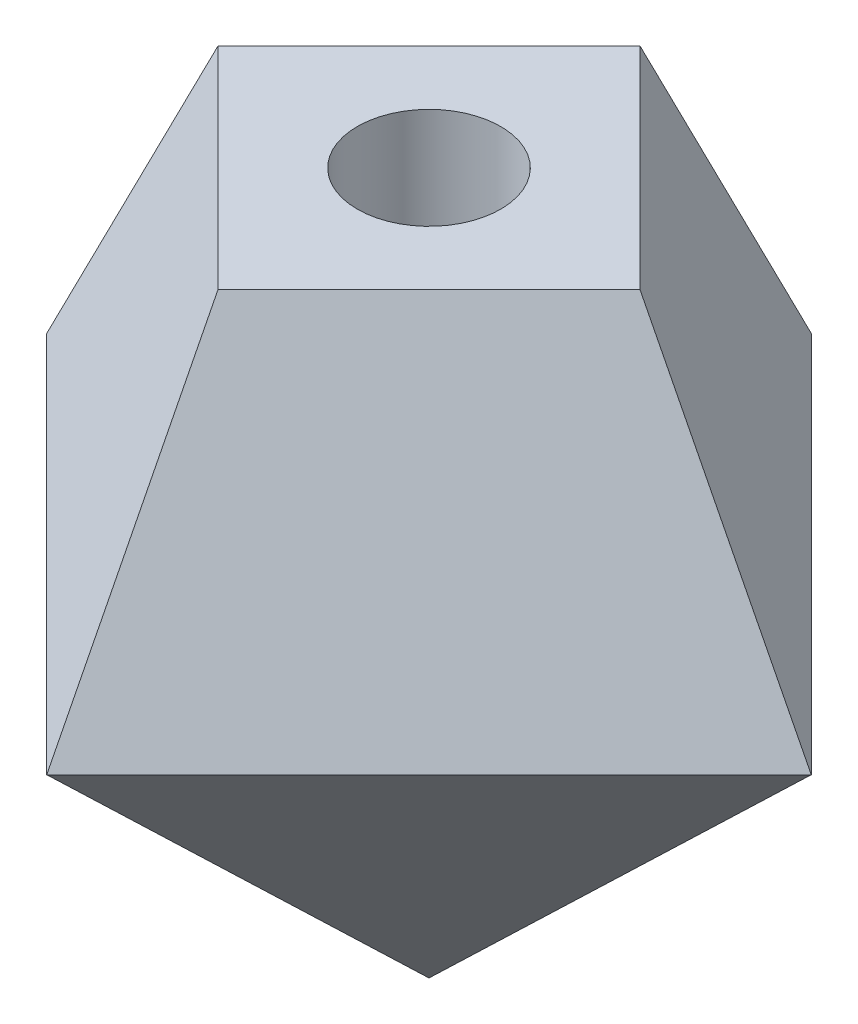
from build123d import *

# Parameters (mm, degrees)
BOSS_EXTRUDE1_DEPTH = 25.4
SKETCH2_W           = 48.842738796
SKETCH2_H           = 57.963308492
CUT_EXTRUDE1_DEPTH  = 25.4
CIRPATTERN1_COUNT   = 4
BOSS_EXTRUDE2_DEPTH = 25.4
SKETCH4_W           = 55.511744094
SKETCH4_H           = 37.462262811
CUT_EXTRUDE2_DEPTH  = 25.4
CIRPATTERN2_COUNT   = 4
SKETCH5_R           = 4.7625
CUT_EXTRUDE3_DEPTH  = 25.4


with BuildPart() as part:
    # Sketch1 → Boss-Extrude1 (new body)
    with BuildSketch(Plane.XY):
        Polygon((64.875616583, 27.293462823), (90.275616583, 27.293462823), (90.275616583, 49.518462823), (76.253828643, 49.518462823), align=None)
    boss_extrude1 = extrude(amount=BOSS_EXTRUDE1_DEPTH)

    # Sketch2 → Cut-Extrude1 (cut)
    with BuildSketch(Plane(origin=(22.502369916, -11.520213127, -22.502369916), x_dir=(0.7469488589136901, 0.3029911037986301, 0.5918308822513607), z_dir=(-0.664881494830121, 0.3403897702119252, 0.6648814948301214))):
        with Locations((74.048071209, 28.981654246)):
            Rectangle(SKETCH2_W, SKETCH2_H)
    cut_extrude1 = extrude(amount=CUT_EXTRUDE1_DEPTH, mode=Mode.SUBTRACT)

    # CirPattern1: Boss-Extrude1, Cut-Extrude1 ×4 about axis
    cirpattern1_axis = Axis((90.275616583, 0, 0), (0, 1, 0))
    add([boss_extrude1.rotate(cirpattern1_axis, i * 360 / CIRPATTERN1_COUNT) for i in range(1, CIRPATTERN1_COUNT)])
    add([cut_extrude1.rotate(cirpattern1_axis, i * 360 / CIRPATTERN1_COUNT) for i in range(1, CIRPATTERN1_COUNT)], mode=Mode.SUBTRACT)

    # Sketch3 → Boss-Extrude2 (add)
    with BuildSketch(Plane.XY):
        Polygon((90.275616583, 27.293462823), (64.875616583, 27.293462823), (90.275616583, 2.897951184), align=None)
    boss_extrude2 = extrude(amount=BOSS_EXTRUDE2_DEPTH)

    # Sketch4 → Cut-Extrude2 (cut)
    with BuildSketch(Plane(origin=(30.250165476, 31.49571997, -30.250165476), x_dir=(0.822040500476201, -0.41068588128331385, 0.3944445746760687), z_dir=(0.5694290259346084, 0.5928753400558371, -0.56942902593461))):
        with Locations((65.735556872, -20.321660951)):
            Rectangle(SKETCH4_W, SKETCH4_H)
    cut_extrude2 = extrude(amount=-CUT_EXTRUDE2_DEPTH, mode=Mode.SUBTRACT)

    # CirPattern2: Boss-Extrude2, Cut-Extrude2 ×4 about axis
    cirpattern2_axis = Axis((90.275616583, 0, 0), (0, 1, 0))
    add([boss_extrude2.rotate(cirpattern2_axis, i * 360 / CIRPATTERN2_COUNT) for i in range(1, CIRPATTERN2_COUNT)])
    add([cut_extrude2.rotate(cirpattern2_axis, i * 360 / CIRPATTERN2_COUNT) for i in range(1, CIRPATTERN2_COUNT)], mode=Mode.SUBTRACT)

    # Sketch5 → Cut-Extrude3 (cut)
    with BuildSketch(Plane(origin=(0, 49.518462823, 0), x_dir=(1, 0, 0), z_dir=(0, 1, 0))):
        with Locations(Location((90.275616583, 0, 0), (0, 0, 270))):
            Circle(SKETCH5_R)
    extrude(amount=-CUT_EXTRUDE3_DEPTH, mode=Mode.SUBTRACT)


solid = part.part
